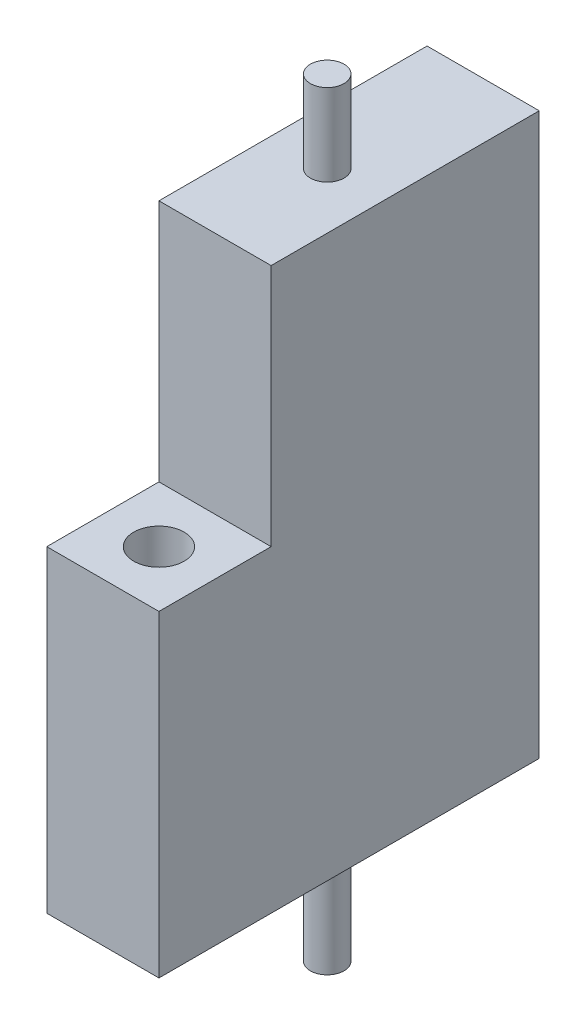
from build123d import *

# Parameters (mm, degrees)
CUT_EXTRUDE_START     = -10
CUT_EXTRUDE_1_DEPTH   = 10
EXTRUDE_START         = -250
SKETCH_3_R            = 50
SKETCH_3_R_2          = 32.5
EXTRUDE_1_DEPTH       = 250
EXTRUDE_7_DEPTH       = 250
EXTRUDE_8_DEPTH       = 50
EXTRUDE_8_DEPTH_BACK  = 50
SKETCH_5_R            = 4.77
CUT_EXTRUDE_2_DEPTH   = 9.525
SKETCH_7_W            = 44.95012806
SKETCH_7_H            = 44.95012806
CUT_EXTRUDE_3_DEPTH   = 33
SKETCH_12_W           = 100
SKETCH_12_H           = 500
EXTRUDE_10_DEPTH      = 239
EXTRUDE_12_DEPTH      = 73
EXTRUDE_12_DEPTH_BACK = 612
SKETCH_13_R           = 15


with BuildPart() as part:
    # 草图1 → 旋转1 (revolve)
    with BuildSketch(Plane.XY):
        Polygon((16.5, 10), (1, 10), (1, 102), (0, 102), (0, 250), (-10, 250), (-10, 0), (16.5, 0), align=None)
        Polygon((28.5, 10), (28.5, 0), (55, 0), (55, 250), (45, 250), (45, 102), (44, 102), (44, 10), align=None)
    revolve(axis=Axis((22.5, 0, 0), (0, 1, 0)))

    # 草图2 → 切除-拉伸1 (cut)
    with BuildSketch(Plane.XZ.offset(CUT_EXTRUDE_START)):
        with BuildLine():
            Line((30.2, 2), (28.156854249, 2))
            ThreePointArc((28.156854249, 2), (28.5, 0), (28.156854249, -2))
            Line((28.156854249, -2), (30.2, -2))
            Line((30.2, -2), (30.2, 2))
        make_face()
    extrude(amount=CUT_EXTRUDE_1_DEPTH, mode=Mode.SUBTRACT)

    # 草图3 → 凸台-拉伸1 (add)
    with BuildSketch(Plane(origin=(0, 250, 0), x_dir=(1, 0, 0), z_dir=(0, 1, 0)).offset(EXTRUDE_START)):
        with Locations((22.5, 0)):
            Circle(SKETCH_3_R)
        with Locations((22.5, 0)):
            Circle(SKETCH_3_R_2, mode=Mode.SUBTRACT)
    extrude(amount=EXTRUDE_1_DEPTH)

    # 草图3<5> → 凸台-拉伸7 (add)
    with BuildSketch(Plane(origin=(0, 250, 0), x_dir=(1, 0, 0), z_dir=(0, 1, 0)).offset(EXTRUDE_START)):
        with BuildLine():
            ThreePointArc((22.5, -50), (-12.855339059, -35.355339059), (-27.5, 0))
            Line((-27.5, 0), (-27.5, -50))
            Line((-27.5, -50), (22.5, -50))
        make_face()
        with BuildLine():
            Line((-27.5, 50), (-27.5, 0))
            ThreePointArc((-27.5, 0), (-12.855339059, 35.355339059), (22.5, 50))
            Line((22.5, 50), (-27.5, 50))
        make_face()
        with BuildLine():
            Line((72.5, 50), (22.5, 50))
            ThreePointArc((22.5, 50), (57.855339059, 35.355339059), (72.5, 0))
            Line((72.5, 0), (72.5, 50))
        make_face()
        with BuildLine():
            ThreePointArc((72.5, 0), (57.855339059, -35.355339059), (22.5, -50))
            Line((22.5, -50), (72.5, -50))
            Line((72.5, -50), (72.5, 0))
        make_face()
    extrude(amount=EXTRUDE_7_DEPTH)

    # 草图1<21> → 凸台-拉伸8 (add, two sides: drawn at the far end of the back side and taken through both)
    with BuildSketch(Plane.XY.offset(-EXTRUDE_8_DEPTH_BACK)):
        Polygon((16.5, 0), (0, 0), (-10, 0), (-27.5, 0), (-27.5, -33), (72.5, -33), (72.5, 0), (55, 0), (45, 0), (28.5, 0), align=None)
    extrude(amount=EXTRUDE_8_DEPTH + EXTRUDE_8_DEPTH_BACK)

    # 草图5 → 切除-拉伸2 (cut)
    with BuildSketch(Plane.XZ.offset(33)):
        with Locations((-16.030339059, 0)):
            Circle(SKETCH_5_R)
        with Locations((-4.74506403, 27.24506403)):
            Circle(SKETCH_5_R)
        with Locations((22.5, 38.530339059)):
            Circle(SKETCH_5_R)
        with Locations((49.74506403, 27.24506403)):
            Circle(SKETCH_5_R)
        with Locations((61.030339059, 0)):
            Circle(SKETCH_5_R)
        with Locations((49.74506403, -27.24506403)):
            Circle(SKETCH_5_R)
        with Locations((22.5, -38.530339059)):
            Circle(SKETCH_5_R)
        with Locations((-4.74506403, -27.24506403)):
            Circle(SKETCH_5_R)
    extrude(amount=-CUT_EXTRUDE_2_DEPTH, mode=Mode.SUBTRACT)

    # 草图7 → 切除-拉伸3 (cut)
    with BuildSketch(Plane.XZ.offset(33)):
        with Locations((22.5, 0)):
            Rectangle(SKETCH_7_W, SKETCH_7_H)
    extrude(amount=-CUT_EXTRUDE_3_DEPTH, mode=Mode.SUBTRACT)

    # 草图12 → 凸台-拉伸10 (add)
    with BuildSketch(Plane(origin=(0, 0, -50), x_dir=(-1, 0, 0), z_dir=(0, 0, -1))):
        with Locations((-22.5, 217)):
            Rectangle(SKETCH_12_W, SKETCH_12_H)
    extrude(amount=EXTRUDE_10_DEPTH)

    # 草图13 → 凸台-拉伸12 (add, two sides: drawn at the far end of the back side and taken through both)
    with BuildSketch(Plane(origin=(0, 467, 0), x_dir=(1, 0, 0), z_dir=(0, 1, 0)).offset(-EXTRUDE_12_DEPTH_BACK)):
        with Locations((22.5, 150)):
            Circle(SKETCH_13_R)
    extrude(amount=EXTRUDE_12_DEPTH + EXTRUDE_12_DEPTH_BACK)


solid = part.part
